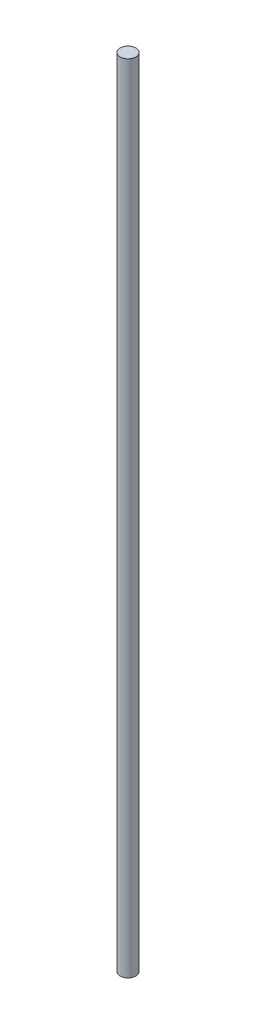
from build123d import *

# Parameters (mm, degrees)
SKETCH1_R           = 4
BOSS_EXTRUDE1_DEPTH = 405


with BuildPart() as part:
    # Sketch1 → Boss-Extrude1 (new body)
    with BuildSketch(Plane(origin=(0, 0, 0), x_dir=(1, 0, 0), z_dir=(0, 1, 0))):
        with Locations(Location((0, 0, 0), (0, 0, 270))):
            Circle(SKETCH1_R)
    extrude(amount=BOSS_EXTRUDE1_DEPTH)


solid = part.part
